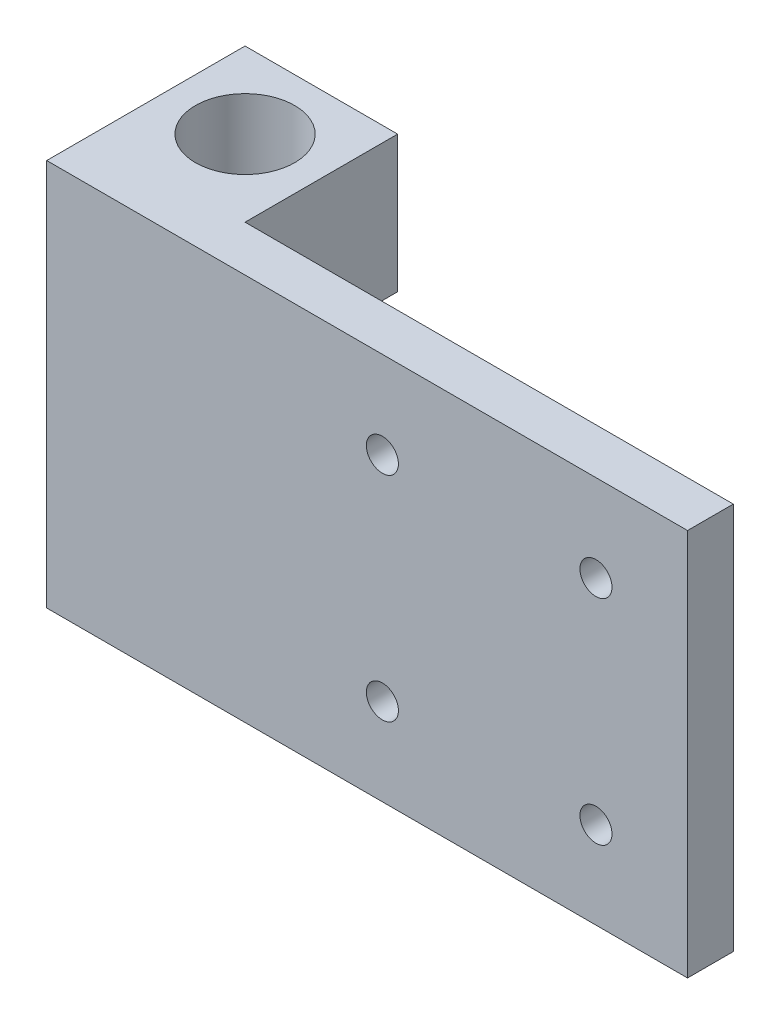
from build123d import *

# Parameters (mm, degrees)
SKETCH1_W           = 84
SKETCH1_H           = 50.8
SKETCH1_R           = 2.1
BOSS_EXTRUDE1_DEPTH = 6
SKETCH3_W           = 20
SKETCH3_H           = 50.8
BOSS_EXTRUDE2_DEPTH = 20
SKETCH5_R           = 6.5
CUT_EXTRUDE1_DEPTH  = 10
CUT_EXTRUDE2_START  = -10
SKETCH6_R           = 6.5
CUT_EXTRUDE2_DEPTH  = 10
SKETCH7_W           = 10
SKETCH7_H           = 15
CUT_EXTRUDE3_DEPTH  = 10


with BuildPart() as part:
    # Sketch1 → Boss-Extrude1 (new body)
    with BuildSketch(Plane.XY):
        with Locations((42, 25.4)):
            Rectangle(SKETCH1_W, SKETCH1_H)
        with Locations((72, 39.4)):
            Circle(SKETCH1_R, mode=Mode.SUBTRACT)
        with Locations((72, 11.4)):
            Circle(SKETCH1_R, mode=Mode.SUBTRACT)
        with Locations((44, 39.4)):
            Circle(SKETCH1_R, mode=Mode.SUBTRACT)
        with Locations((44, 11.4)):
            Circle(SKETCH1_R, mode=Mode.SUBTRACT)
    extrude(amount=BOSS_EXTRUDE1_DEPTH)

    # Sketch3 → Boss-Extrude2 (add)
    with BuildSketch(Plane(origin=(0, 0, 0), x_dir=(-1, 0, 0), z_dir=(0, 0, -1))):
        with Locations((-10, 25.4)):
            Rectangle(SKETCH3_W, SKETCH3_H)
    extrude(amount=BOSS_EXTRUDE2_DEPTH)

    # Sketch5 → Cut-Extrude1 (cut)
    with BuildSketch(Plane(origin=(0, 50.8, 0), x_dir=(1, 0, 0), z_dir=(0, 1, 0))):
        with Locations(Location((10, 10, 0), (0, 0, 270))):
            Circle(SKETCH5_R)
    extrude(amount=-CUT_EXTRUDE1_DEPTH, mode=Mode.SUBTRACT)

    # Sketch6 → Cut-Extrude2 (cut)
    with BuildSketch(Plane.XZ.offset(CUT_EXTRUDE2_START)):
        with Locations(Location((10, -10, 0), (0, 0, 90))):
            Circle(SKETCH6_R)
    extrude(amount=CUT_EXTRUDE2_DEPTH, mode=Mode.SUBTRACT)

    # Sketch7 → Cut-Extrude3 (cut)
    with BuildSketch(Plane(origin=(0, 0, -20), x_dir=(-1, 0, 0), z_dir=(0, 0, -1))):
        with Locations((-15, 25.4)):
            Rectangle(SKETCH7_W, SKETCH7_H)
    extrude(amount=-CUT_EXTRUDE3_DEPTH, mode=Mode.SUBTRACT)


solid = part.part
